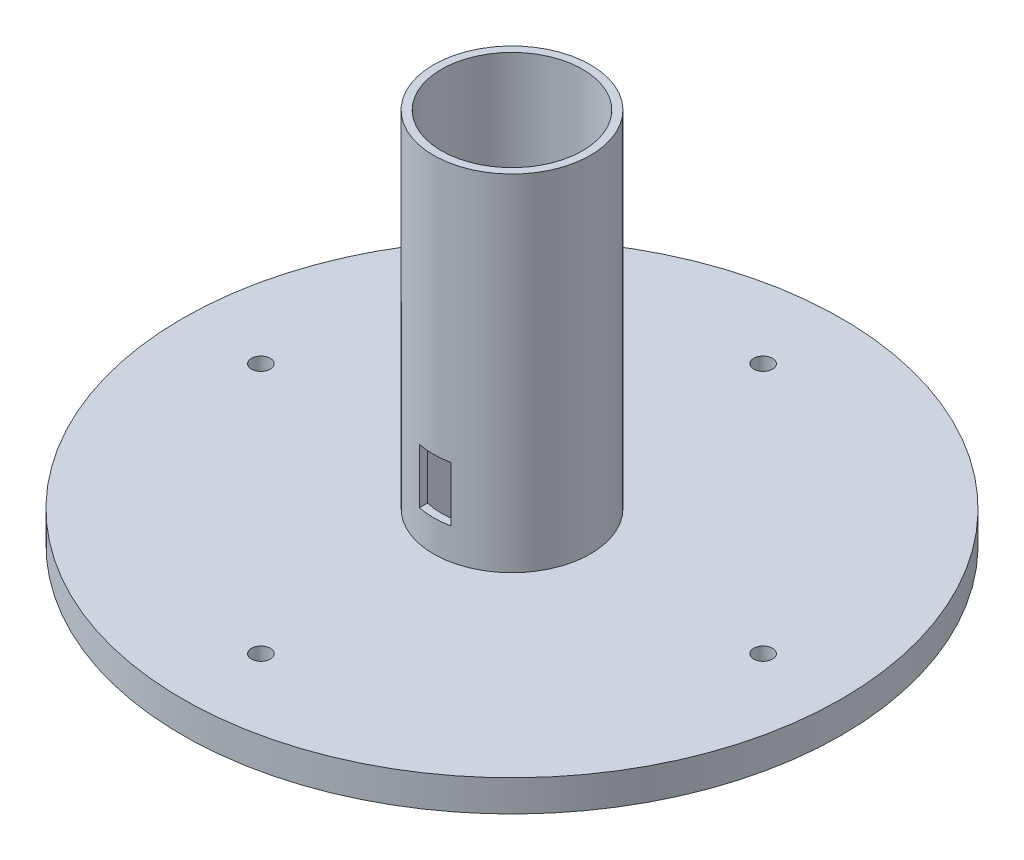
from build123d import *

# Parameters (mm, degrees)
SKETCH2_R          = 28.575
CUT_EXTRUDE2_DEPTH = 228.6
CUT_EXTRUDE5_DEPTH = 8.89
SKETCH4_R          = 3.81
CUT_EXTRUDE4_DEPTH = 12.7


with BuildPart() as part:
    # Sketch1 → Revolve1 (revolve)
    with BuildSketch(Plane.XY, mode=Mode.PRIVATE) as revolve1_sk:
        Polygon((0, -114.3), (0, -279.4), (31.75, -279.4), (31.75, -266.7), (133.35, -266.7), (133.35, -254), (31.75, -254), (31.75, -114.3), align=None)
    revolve(revolve1_sk.sketch.rotate(Axis((0, 0, 0), (0, -1, 0)), 180), axis=Axis((0, 0, 0), (0, -1, 0)))

    # Sketch2 → Cut-Extrude2 (cut)
    with BuildSketch(Plane.XZ.offset(279.4)):
        Circle(SKETCH2_R)
    extrude(amount=-CUT_EXTRUDE2_DEPTH, mode=Mode.SUBTRACT)

    # Sketch3 → Cut-Extrude5 (cut)
    with BuildSketch(Plane.XY.offset(31.75)):
        Polygon((-6.35, -241.3), (6.35, -241.3), (6.35, -219.075), (0, -219.075), (-6.35, -219.075), align=None)
    extrude(amount=-CUT_EXTRUDE5_DEPTH, mode=Mode.SUBTRACT)

    # Sketch4 → Cut-Extrude4 (cut)
    with BuildSketch(Plane.XZ.offset(266.7)):
        with Locations((0, 101.6)):
            Circle(SKETCH4_R)
        with Locations((101.6, 0)):
            Circle(SKETCH4_R)
        with Locations((0, -101.6)):
            Circle(SKETCH4_R)
        with Locations((-101.6, 0)):
            Circle(SKETCH4_R)
    extrude(amount=-CUT_EXTRUDE4_DEPTH, mode=Mode.SUBTRACT)


solid = part.part
